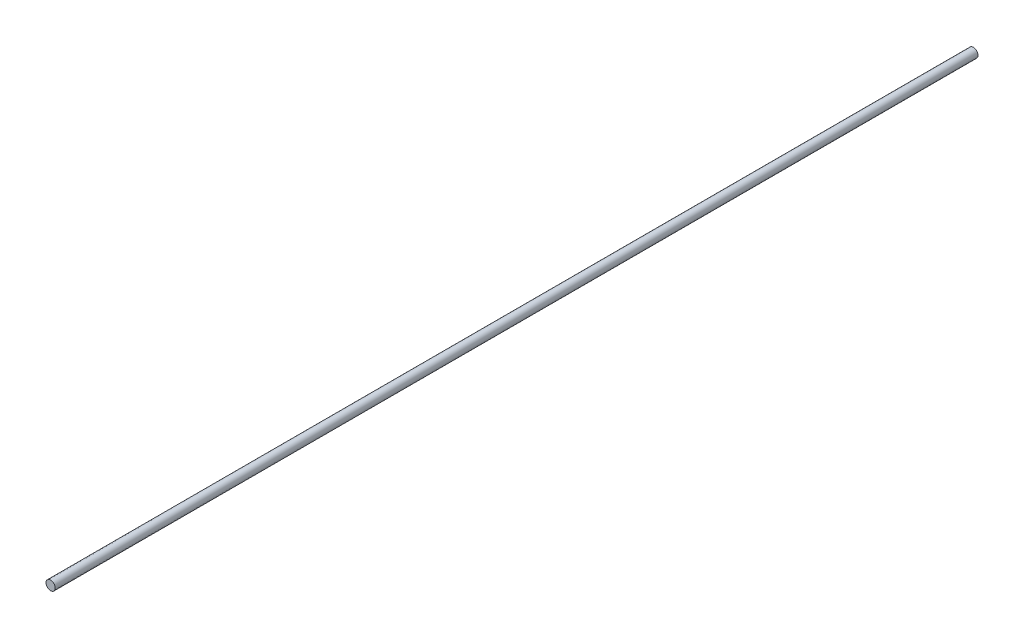
from build123d import *

# Parameters (mm, degrees)
SKETCH1_R      = 1
EXTRUDE1_DEPTH = 100


with BuildPart() as part:
    # Sketch1 → Extrude1 (new, symmetric)
    with BuildSketch(Plane.XY):
        Circle(SKETCH1_R)
    extrude(amount=EXTRUDE1_DEPTH, both=True)


solid = part.part
